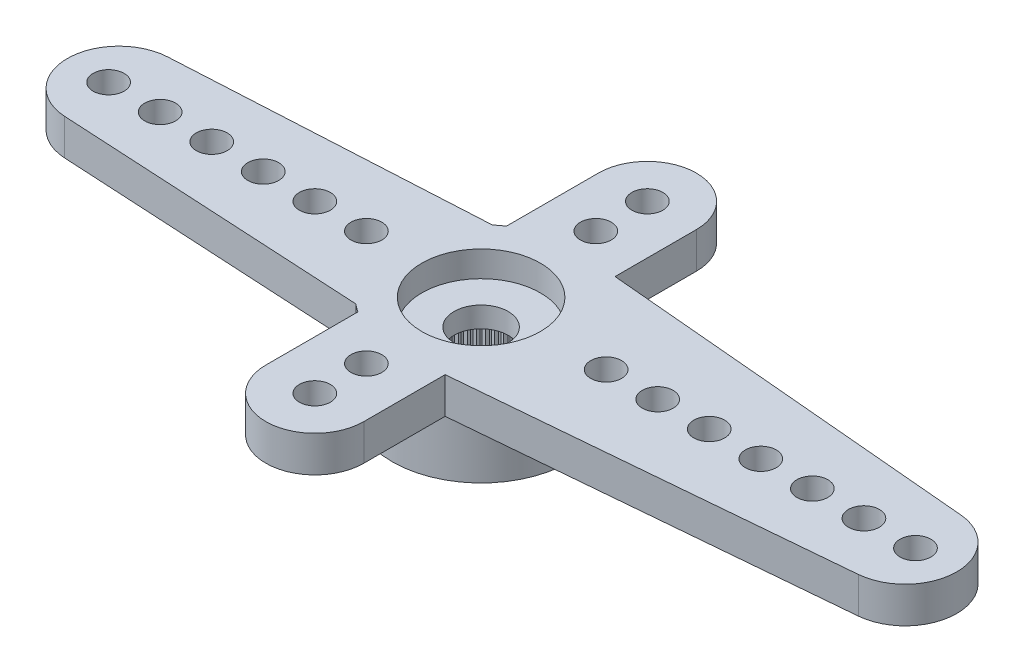
from build123d import *

# Parameters (mm, degrees)
RESSALTO_EXTRUS_O1_DEPTH = 1.4
ESBO_O2_R                = 3.45
RESSALTO_EXTRUS_O2_DEPTH = 2.4
FURO1_D                  = 1.2
PADR_O_LINEAR1_COUNT     = 6
PADR_O_LINEAR1_PITCH     = 2
RESSALTO_EXTRUS_O3_DEPTH = 1.4
FURO2_D                  = 1.2
PADR_O_LINEAR2_COUNT     = 7
PADR_O_LINEAR2_PITCH     = 2
RESSALTO_EXTRUS_O4_DEPTH = 1.4
FURO3_D                  = 1.2
PADR_O_LINEAR3_COUNT     = 2
PADR_O_LINEAR3_PITCH     = 2
PADR_OCIRCULAR1_COUNT    = 2
PADR_OCIRCULAR1_COPY_1_D = 1.2
FURO4_D                  = 4.95
FURO4_DEPTH              = 2
FURO5_D                  = 4.6
FURO5_DEPTH              = 1
FURO6_D                  = 2.1
RESSALTO_EXTRUS_O5_START = -2
RESSALTO_EXTRUS_O5_DEPTH = 2
PADR_OCIRCULAR2_COUNT    = 60


with BuildPart() as part:
    # Esboço1 → Ressalto-extrusão1 (new body)
    with BuildSketch(Plane(origin=(0, 0, 0), x_dir=(1, 0, 0), z_dir=(0, 1, 0))):
        with BuildLine():
            Line((-14.159121967, 1.99702088), (-2.209072203, 2.65))
            ThreePointArc((-2.209072203, 2.65), (3.45, 0), (-2.209072203, -2.65))
            Line((-2.209072203, -2.65), (-14.159121967, -1.99702088))
            ThreePointArc((-14.159121967, -1.99702088), (-16.05, 0), (-14.159121967, 1.99702088))
        make_face()
    extrude(amount=-RESSALTO_EXTRUS_O1_DEPTH)

    # Esboço2 → Ressalto-extrusão2 (add)
    with BuildSketch(Plane.XZ.offset(1.4)):
        with Locations(Location((0, 0, 0), (0, 0, 90))):
            Circle(ESBO_O2_R)
    extrude(amount=RESSALTO_EXTRUS_O2_DEPTH)

    # Furo1 (through all)
    with Locations(Plane(origin=(0, 0, 0), x_dir=(1, 0, 0), z_dir=(0, 1, 0))):
        with Locations((-14.45, 0)):
            furo1 = Hole(FURO1_D / 2)

    # Padrão linear1: Furo1 ×6
    with Locations(*[(i * PADR_O_LINEAR1_PITCH, 0, 0) for i in range(1, PADR_O_LINEAR1_COUNT)]):
        add(furo1, mode=Mode.SUBTRACT)

    # Esboço12 → Ressalto-extrusão3 (add)
    with BuildSketch(Plane(origin=(0, 0, 0), x_dir=(1, 0, 0), z_dir=(0, 1, 0))):
        with BuildLine():
            Line((0.304103343, 3.436571134), (16.626291793, 1.99221515))
            ThreePointArc((16.626291793, 1.99221515), (18.45, 0), (16.626291793, -1.99221515))
            Line((16.626291793, -1.99221515), (0.304103343, -3.436571134))
            ThreePointArc((0.304103343, -3.436571134), (3.45, 0), (0.304103343, 3.436571134))
        make_face()
    extrude(amount=-RESSALTO_EXTRUS_O3_DEPTH)

    # Furo2 (through all)
    with Locations(Plane(origin=(0, 0, 0), x_dir=(1, 0, 0), z_dir=(0, 1, 0))):
        with Locations((16.85, 0)):
            furo2 = Hole(FURO2_D / 2)

    # Padrão linear2: Furo2 ×7
    with Locations(*[(-i * PADR_O_LINEAR2_PITCH, 0, 0) for i in range(1, PADR_O_LINEAR2_COUNT)]):
        add(furo2, mode=Mode.SUBTRACT)

    # Esboço16 → Ressalto-extrusão4 (add)
    with BuildSketch(Plane(origin=(0, 0, 0), x_dir=(1, 0, 0), z_dir=(0, 1, 0))):
        with BuildLine():
            Line((-1.9, -6.45), (-1.9, 6.45))
            ThreePointArc((-1.9, 6.45), (0, 8.35), (1.9, 6.45))
            Line((1.9, 6.45), (1.9, -6.45))
            ThreePointArc((1.9, -6.45), (0, -8.35), (-1.9, -6.45))
        make_face()
    extrude(amount=-RESSALTO_EXTRUS_O4_DEPTH)

    # Furo3 (through all)
    with Locations(Plane(origin=(0, 0, 0), x_dir=(1, 0, 0), z_dir=(0, 1, 0))):
        with Locations((0, -6.45)):
            furo3 = Hole(FURO3_D / 2)

    # Padrão linear3: Furo3 ×2
    with Locations(*[(0, 0, -i * PADR_O_LINEAR3_PITCH) for i in range(1, PADR_O_LINEAR3_COUNT)]):
        add(furo3, mode=Mode.SUBTRACT)

    # PadrãoCircular1: Furo3 ×2 about axis
    padr_ocircular1_axis = Axis((0, 0, 0), (0, 1, 0))
    for i in range(1, PADR_OCIRCULAR1_COUNT):
        add(furo3.rotate(padr_ocircular1_axis, i * 360 / PADR_OCIRCULAR1_COUNT), mode=Mode.SUBTRACT)

    # PadrãoCircular1 copy 1 (through all)
    with Locations(Plane(origin=(0, 0, 2), x_dir=(-1, 0, 0), z_dir=(0, 1, 0))):
        with Locations((0, -6.45)):
            Hole(PADR_OCIRCULAR1_COPY_1_D / 2)

    # Furo4
    with Locations(Plane(origin=(0, -3.8, 0), x_dir=(-1, 0, 0), z_dir=(0, -1, 0))):
        with Locations((0, 0)):
            Hole(FURO4_D / 2, depth=FURO4_DEPTH)

    # Furo5
    with Locations(Plane(origin=(0, 0, 0), x_dir=(1, 0, 0), z_dir=(0, 1, 0))):
        with Locations((0, 0)):
            Hole(FURO5_D / 2, depth=FURO5_DEPTH)

    # Furo6 (through all)
    with Locations(Plane(origin=(0, 0, 0), x_dir=(1, 0, 0), z_dir=(0, 1, 0))):
        with Locations((0, 0)):
            Hole(FURO6_D / 2)

    # Esboço11 → Ressalto-extrusão5 (add)
    with BuildSketch(Plane.XZ.offset(3.8).offset(RESSALTO_EXTRUS_O5_START)):
        with BuildLine():
            Line((-0.098056786, 2.473056786), (0, 2.375))
            Line((0, 2.375), (0.098056786, 2.473056786))
            ThreePointArc((0.098056786, 2.473056786), (0, 2.475), (-0.098056786, 2.473056786))
        make_face()
    ressalto_extrus_o5 = extrude(amount=RESSALTO_EXTRUS_O5_DEPTH)

    # PadrãoCircular2: Ressalto-extrusão5 ×60 about axis
    padr_ocircular2_axis = Axis((0, 0, 0), (0, 1, 0))
    for i in range(1, PADR_OCIRCULAR2_COUNT):
        add(ressalto_extrus_o5.rotate(padr_ocircular2_axis, i * 360 / PADR_OCIRCULAR2_COUNT))


solid = part.part
